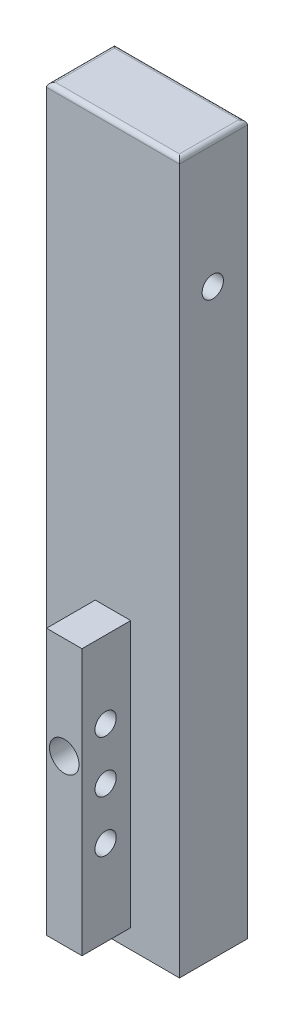
from build123d import *

# Parameters (mm, degrees)
ESBO_O1_W                = 11.5
ESBO_O1_H                = 120
RESSALTO_EXTRUS_O1_DEPTH = 22.5
ESBO_O5_W                = 8.25
ESBO_O5_H                = 45
RESSALTO_EXTRUS_O2_DEPTH = 6
ESBO_O7_R                = 1.8
CORTE_EXTRUS_O1_DEPTH    = 30
CORTE_EXTRUS_O3_REACH    = 76.645
ESBO_O10_R               = 2.5
FILLET1_R                = 0.75


with BuildPart() as part:
    # Esboço1 → Ressalto-extrusão1 (new body)
    with BuildSketch(Plane(origin=(0, 0, 0), x_dir=(0, 0, -1), z_dir=(1, 0, 0))):
        with Locations((5.75, 8.378378378)):
            Rectangle(ESBO_O1_W, ESBO_O1_H)
    extrude(amount=RESSALTO_EXTRUS_O1_DEPTH)

    # Esboço5 → Ressalto-extrusão2 (add)
    with BuildSketch(Plane.ZY.offset(-8.25)):
        with Locations((4.125, -25.871621622)):
            Rectangle(ESBO_O5_W, ESBO_O5_H)
    extrude(amount=-RESSALTO_EXTRUS_O2_DEPTH)

    # Esboço7 → Corte-extrusão1 (cut)
    with BuildSketch(Plane(origin=(22.5, 0, 0), x_dir=(0, 0, -1), z_dir=(1, 0, 0))):
        with Locations((5.625, 46.878378378)):
            Circle(ESBO_O7_R)
        with Locations(Location((-4.25, -33.871621622, 0), (0, 0, 180))):
            Circle(ESBO_O7_R)
        with Locations(Location((-4.25, -25.121621622, 0), (0, 0, 180))):
            Circle(ESBO_O7_R)
        with Locations(Location((-4.25, -16.371621622, 0), (0, 0, 180))):
            Circle(ESBO_O7_R)
    extrude(amount=-CORTE_EXTRUS_O1_DEPTH, mode=Mode.SUBTRACT)

    # Corte-extrusão3: up to this face of the body (flat: up to its plane)
    corte_extrus_o3_end = Plane(part.part.faces().sort_by_distance((11.25, -25.871621622, 8.25))[0])
    # Esboço10 → Corte-extrusão3 (cut, up to the picked face)
    with BuildSketch(Plane(origin=(0, 0, -11.5), x_dir=(-1, 0, 0), z_dir=(0, 0, -1)), mode=Mode.PRIVATE) as corte_extrus_o3_sk1:
        with Locations((-11.25, -20.621621622)):
            Circle(ESBO_O10_R)
    corte_extrus_o3_tool1 = split(extrude(corte_extrus_o3_sk1.sketch, amount=-CORTE_EXTRUS_O3_REACH, mode=Mode.PRIVATE), bisect_by=corte_extrus_o3_end, keep=Keep.BOTH, mode=Mode.PRIVATE)
    add(corte_extrus_o3_tool1.solids().sort_by(Axis((11.25, -20.621622, -11.5), (0, 0, 1)))[0], mode=Mode.SUBTRACT)

    # Fillet1
    fillet1_edges = [part.edges().sort_by_distance(p)[0] for p in [
        (22.5, 68.378378378, -5.75),
        (0, 68.378378378, -5.75),
        (11.25, 68.378378378, -11.5),
        (11.25, 68.378378378, 0),
    ]]
    fillet(fillet1_edges, radius=FILLET1_R)


solid = part.part
